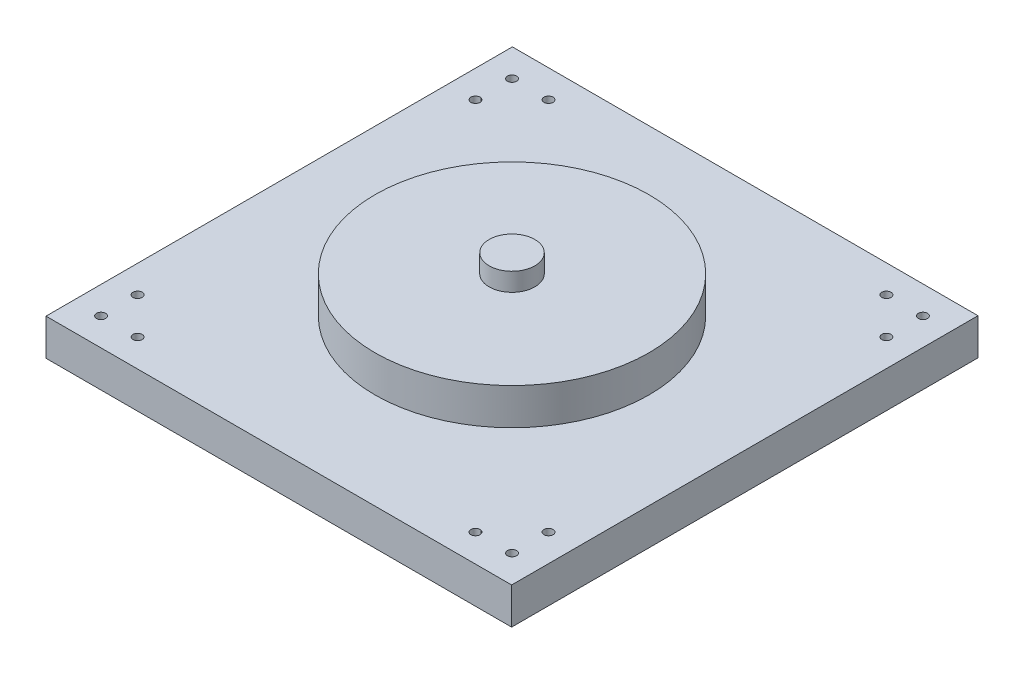
from build123d import *

# Parameters (mm, degrees)
SKETCH1_W           = 64.757022316
SKETCH1_H           = 64.860932096
SKETCH1_R           = 0.635
BOSS_EXTRUDE1_DEPTH = 5.08
SKETCH2_R           = 19.05
BOSS_EXTRUDE2_DEPTH = 5.08
SKETCH3_R           = 3.175
BOSS_EXTRUDE3_DEPTH = 2.54


with BuildPart() as part:
    # Sketch1 → Boss-Extrude1 (new body)
    with BuildSketch(Plane(origin=(0, 0, 0), x_dir=(1, 0, 0), z_dir=(0, 1, 0))):
        Rectangle(SKETCH1_W, SKETCH1_H)
        with Locations(Location((-28.575, 28.575, 0), (0, 0, 270))):
            Circle(SKETCH1_R, mode=Mode.SUBTRACT)
        with Locations(Location((-23.495, 28.575, 0), (0, 0, 270))):
            Circle(SKETCH1_R, mode=Mode.SUBTRACT)
        with Locations(Location((-28.575, 23.495, 0), (0, 0, 270))):
            Circle(SKETCH1_R, mode=Mode.SUBTRACT)
        with Locations(Location((28.575, 28.575, 0), (0, 0, 270))):
            Circle(SKETCH1_R, mode=Mode.SUBTRACT)
        with Locations(Location((23.495, 28.575, 0), (0, 0, 270))):
            Circle(SKETCH1_R, mode=Mode.SUBTRACT)
        with Locations(Location((28.575, 23.495, 0), (0, 0, 270))):
            Circle(SKETCH1_R, mode=Mode.SUBTRACT)
        with Locations(Location((28.575, -28.575, 0), (0, 0, 270))):
            Circle(SKETCH1_R, mode=Mode.SUBTRACT)
        with Locations(Location((28.575, -23.495, 0), (0, 0, 270))):
            Circle(SKETCH1_R, mode=Mode.SUBTRACT)
        with Locations(Location((23.495, -28.575, 0), (0, 0, 270))):
            Circle(SKETCH1_R, mode=Mode.SUBTRACT)
        with Locations(Location((-28.575, -28.575, 0), (0, 0, 270))):
            Circle(SKETCH1_R, mode=Mode.SUBTRACT)
        with Locations(Location((-28.575, -23.495, 0), (0, 0, 270))):
            Circle(SKETCH1_R, mode=Mode.SUBTRACT)
        with Locations(Location((-23.495, -28.575, 0), (0, 0, 270))):
            Circle(SKETCH1_R, mode=Mode.SUBTRACT)
    extrude(amount=BOSS_EXTRUDE1_DEPTH)

    # Sketch2 → Boss-Extrude2 (add)
    with BuildSketch(Plane(origin=(0, 5.08, 0), x_dir=(1, 0, 0), z_dir=(0, 1, 0))):
        with Locations(Location((0, 0, 0), (0, 0, 270))):
            Circle(SKETCH2_R)
    extrude(amount=BOSS_EXTRUDE2_DEPTH)

    # Sketch3 → Boss-Extrude3 (add)
    with BuildSketch(Plane(origin=(0, 10.16, 0), x_dir=(1, 0, 0), z_dir=(0, 1, 0))):
        with Locations(Location((0, 0, 0), (0, 0, 270))):
            Circle(SKETCH3_R)
    extrude(amount=BOSS_EXTRUDE3_DEPTH)


solid = part.part
